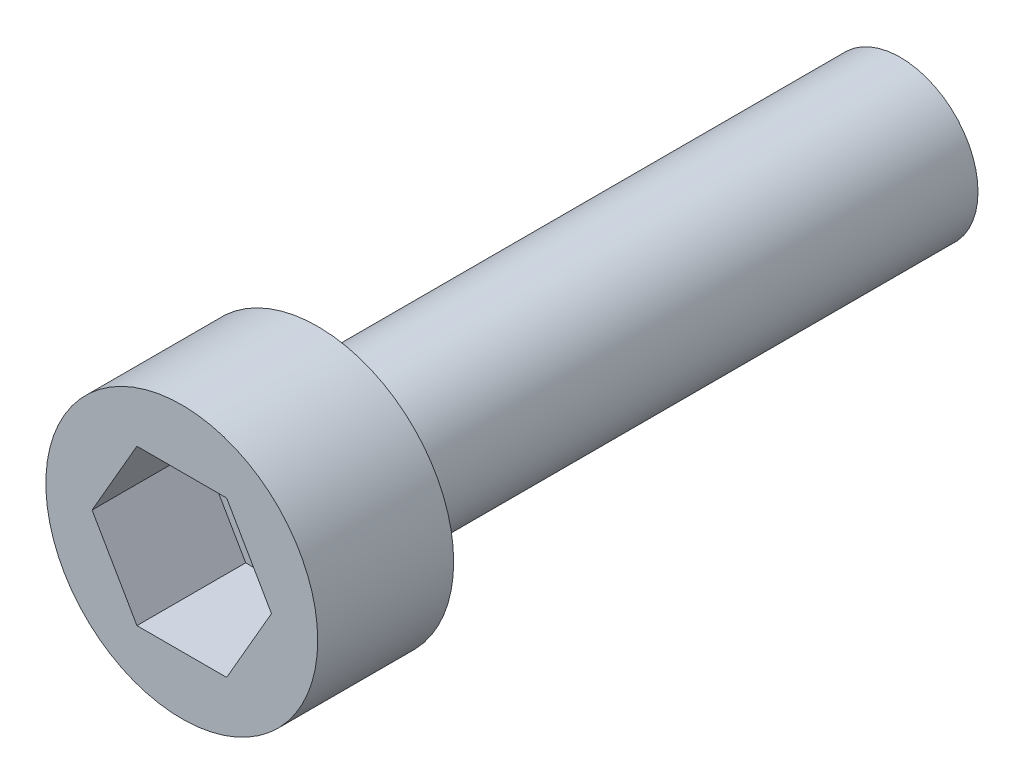
from build123d import *

# Parameters (mm, degrees)
SKETCH1_R                   = 3.5
HEAD_BOSS_EXTRUDE1_DEPTH    = 3.5
HEAD_HEX_CUT_EXTRUDE1_DEPTH = 2.8
SKETCH2_R                   = 2
SCREW_BOSS_EXTRUDE2_DEPTH   = 15


with BuildPart() as part:
    # Sketch1 → Head Boss-Extrude1 (new body)
    with BuildSketch(Plane.XY):
        Circle(SKETCH1_R)
    extrude(amount=HEAD_BOSS_EXTRUDE1_DEPTH)

    # Sketch3 → Head Hex Cut-Extrude1 (cut)
    with BuildSketch(Plane.XY.offset(3.5)):
        Polygon((-1.154700538, 2), (1.154700538, 2), (2.309401077, 0), (1.154700538, -2), (-1.154700538, -2), (-2.309401077, 0), align=None)
    extrude(amount=-HEAD_HEX_CUT_EXTRUDE1_DEPTH, mode=Mode.SUBTRACT)

    # Sketch2 → Screw Boss-Extrude2 (add)
    with BuildSketch(Plane.XY):
        Circle(SKETCH2_R)
    extrude(amount=-SCREW_BOSS_EXTRUDE2_DEPTH)


solid = part.part
